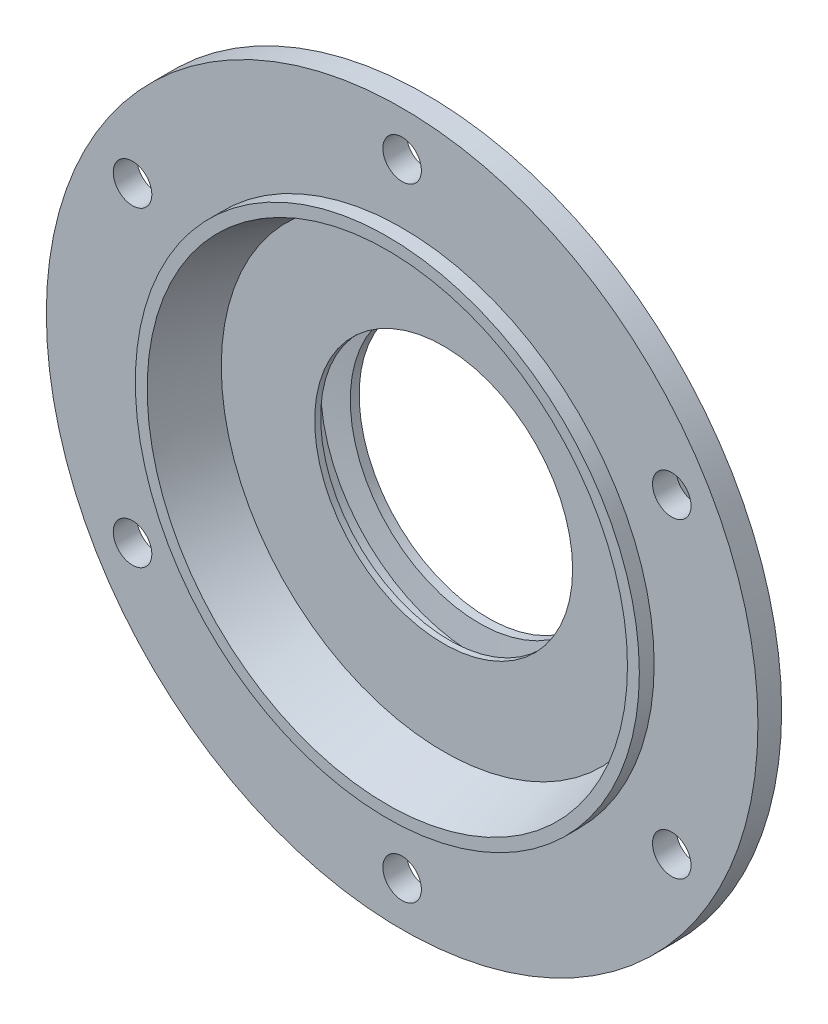
from build123d import *

# Parameters (mm, degrees)
SKETCH_2_R               = 6.5
CUT_EXTRUDE_1_DEPTH      = 172
PATTERN_CIRCULAR_1_COUNT = 6


with BuildPart() as part:
    # 草图1 → 旋转1 (revolve)
    with BuildSketch(Plane(origin=(0, 0, 0), x_dir=(0, 0, -1), z_dir=(1, 0, 0)), mode=Mode.PRIVATE) as revolve_1_sk:
        Polygon((0, 43.5), (-3, 43.5), (-4, 52.5), (-12, 52.5), (-13, 43.5), (-15, 43.5), (-15, 75), (-34, 81), (-34, 85), (-29, 85), (-29, 120), (-21, 120), (-21, 85), (-7, 85), (-7, 63), (0, 63), align=None)
    revolve(revolve_1_sk.sketch.rotate(Axis((0, 0, 1000), (0, 0, -1)), 90), axis=Axis((0, 0, 1000), (0, 0, -1)))

    # 草图2 → 切除-拉伸1 (cut, through all)
    with BuildSketch(Plane(origin=(0, 0, 21), x_dir=(-1, 0, 0), z_dir=(0, 0, -1))):
        with Locations((0, 105)):
            Circle(SKETCH_2_R)
    cut_extrude_1 = extrude(amount=-CUT_EXTRUDE_1_DEPTH, mode=Mode.SUBTRACT)

    # 阵列(圆周)1: 切除-拉伸1 ×6 about axis
    pattern_circular_1_axis = Axis((0, 0, 0), (0, 0, 1))
    for i in range(1, PATTERN_CIRCULAR_1_COUNT):
        add(cut_extrude_1.rotate(pattern_circular_1_axis, i * 360 / PATTERN_CIRCULAR_1_COUNT), mode=Mode.SUBTRACT)


solid = part.part
